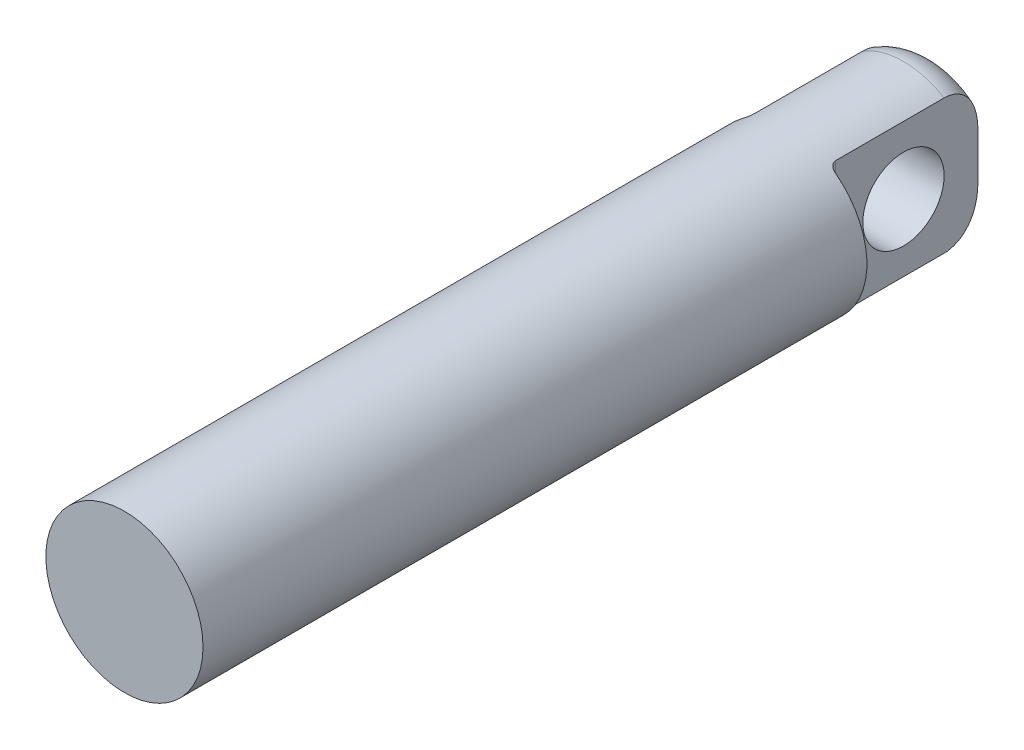
from build123d import *

# Parameters (mm, degrees)
SKETCH1_R           = 2.9
BOSS_EXTRUDE1_DEPTH = 30
CUT_EXTRUDE1_DEPTH  = 5.5
SKETCH3_R           = 1.5
CUT_EXTRUDE2_DEPTH  = 31.45931713
FILLET1_R           = 1.25
FILLET2_R           = 0.25


with BuildPart() as part:
    # Sketch1 → Boss-Extrude1 (new body)
    with BuildSketch(Plane.XY):
        Circle(SKETCH1_R)
    extrude(amount=BOSS_EXTRUDE1_DEPTH)

    # Sketch2 → Cut-Extrude1 (cut)
    with BuildSketch(Plane(origin=(0, 0, 0), x_dir=(-1, 0, 0), z_dir=(0, 0, -1))):
        with BuildLine():
            Line((-1.5, -2.481934729), (-1.5, 2.481934729))
            ThreePointArc((-1.5, 2.481934729), (-2.9, 0), (-1.5, -2.481934729))
        make_face()
        with BuildLine():
            ThreePointArc((2.9, 0), (2.525866188, 1.424780685), (1.5, 2.481934729))
            Line((1.5, 2.481934729), (1.5, -2.481934729))
            ThreePointArc((1.5, -2.481934729), (2.525866188, -1.424780685), (2.9, 0))
        make_face()
    extrude(amount=-CUT_EXTRUDE1_DEPTH, mode=Mode.SUBTRACT)

    # Sketch3 → Cut-Extrude2 (cut, through all)
    with BuildSketch(Plane.ZY.offset(1.5)):
        with Locations((2.75, 0)):
            Circle(SKETCH3_R)
    extrude(amount=-CUT_EXTRUDE2_DEPTH, mode=Mode.SUBTRACT)

    # Fillet1
    fillet1_edges = [part.edges().sort_by_distance(p)[0] for p in [
        (0, 2.9, 0),
        (0, -2.9, 0),
    ]]
    fillet(fillet1_edges, radius=FILLET1_R)

    # Fillet2
    fillet2_edges = [part.edges().sort_by_distance(p)[0] for p in [
        (1.5, 0, 5.5),
        (-1.5, 0, 5.5),
    ]]
    fillet(fillet2_edges, radius=FILLET2_R)


solid = part.part
